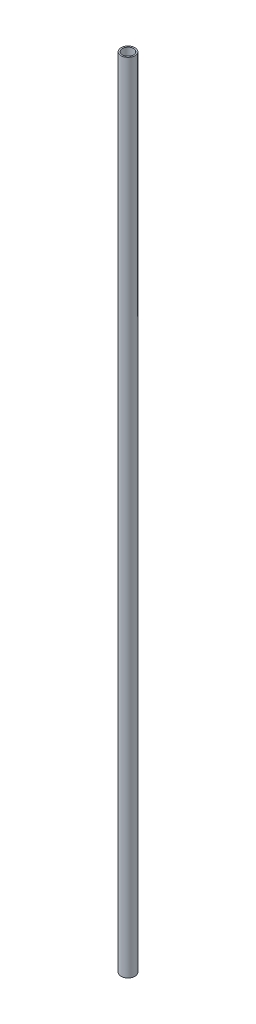
from build123d import *

# Parameters (mm, degrees)
SKETCH1_R           = 2.5
SKETCH1_R_2         = 2
BOSS_EXTRUDE1_DEPTH = 143.5


with BuildPart() as part:
    # Sketch1 → Boss-Extrude1 (new, symmetric)
    with BuildSketch(Plane(origin=(0, 0, 0), x_dir=(1, 0, 0), z_dir=(0, 1, 0))):
        with Locations(Location((0, 0, 0), (0, 0, 270))):
            Circle(SKETCH1_R)
        with Locations(Location((0, 0, 0), (0, 0, 270))):
            Circle(SKETCH1_R_2, mode=Mode.SUBTRACT)
    extrude(amount=BOSS_EXTRUDE1_DEPTH, both=True)


solid = part.part
